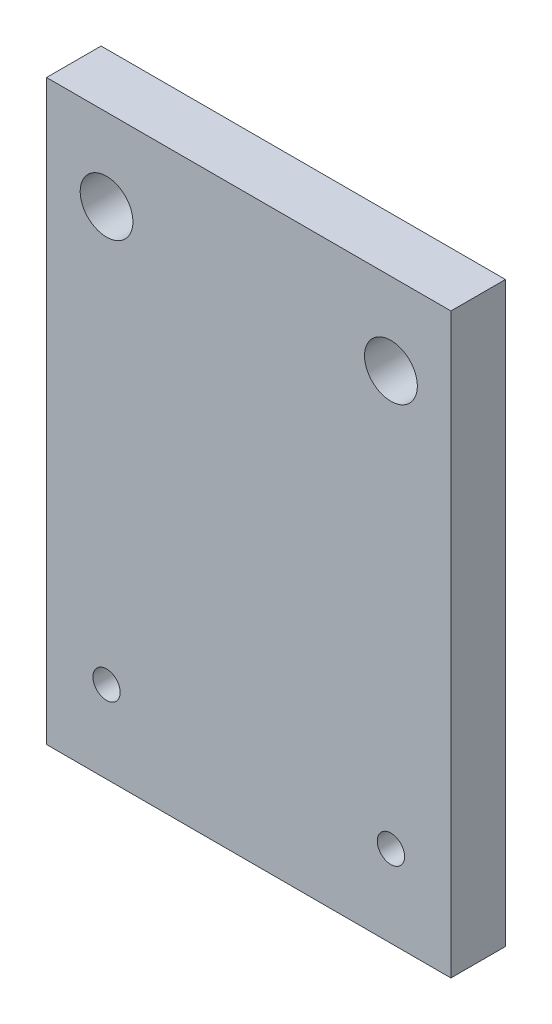
from build123d import *

# Parameters (mm, degrees)
SKETCH1_W           = 44.45
SKETCH1_H           = 63.5
SKETCH1_R           = 2.900000042
SKETCH1_R_2         = 1.5
BOSS_EXTRUDE1_DEPTH = 5.9944


with BuildPart() as part:
    # Sketch1 → Boss-Extrude1 (new body)
    with BuildSketch(Plane.XY):
        with Locations((22.225, -31.75)):
            Rectangle(SKETCH1_W, SKETCH1_H)
        with Locations(Location((6.595000018, -9.000000034, 0), (0, 0, 180))):
            Circle(SKETCH1_R, mode=Mode.SUBTRACT)
        with Locations(Location((37.854999982, -9.000000034, 0), (0, 0, 180))):
            Circle(SKETCH1_R, mode=Mode.SUBTRACT)
        with Locations(Location((6.595000018, -54.499999966, 0), (0, 0, 180))):
            Circle(SKETCH1_R_2, mode=Mode.SUBTRACT)
        with Locations(Location((37.854999982, -54.499999966, 0), (0, 0, 180))):
            Circle(SKETCH1_R_2, mode=Mode.SUBTRACT)
    extrude(amount=BOSS_EXTRUDE1_DEPTH)


solid = part.part
